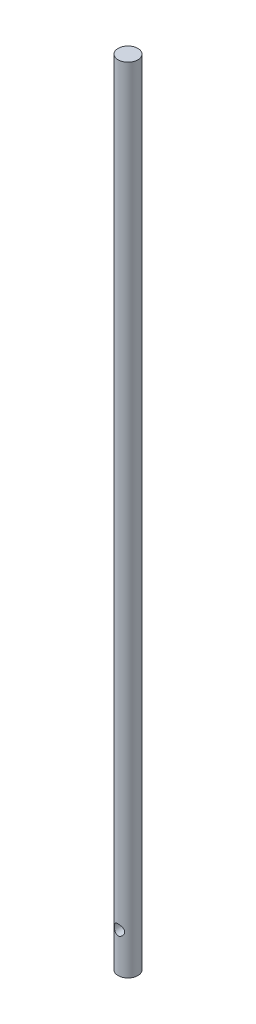
from build123d import *

# Parameters (mm, degrees)
SKETCH1_R               = 2.5
BOSS_EXTRUDE1_DEPTH     = 200
CUT_EXTRUDE1_DEPTH      = 201.031247559
CUT_EXTRUDE1_DEPTH_BACK = 201.031247559
SKETCH2_R               = 1.3


with BuildPart() as part:
    # Sketch1 → Boss-Extrude1 (new body)
    with BuildSketch(Plane(origin=(0, 0, 0), x_dir=(1, 0, 0), z_dir=(0, 1, 0))):
        with Locations(Location((0, 0, 0), (0, 0, 270))):
            Circle(SKETCH1_R)
    extrude(amount=BOSS_EXTRUDE1_DEPTH)

    # Sketch2 → Cut-Extrude1 (cut, two sides: drawn at the far end of the back side and taken through both)
    with BuildSketch(Plane.XY.offset(-CUT_EXTRUDE1_DEPTH_BACK)):
        with Locations(Location((0, 10, 0), (0, 0, 90.000000002))):
            Circle(SKETCH2_R)
    extrude(amount=CUT_EXTRUDE1_DEPTH + CUT_EXTRUDE1_DEPTH_BACK, mode=Mode.SUBTRACT)


solid = part.part
